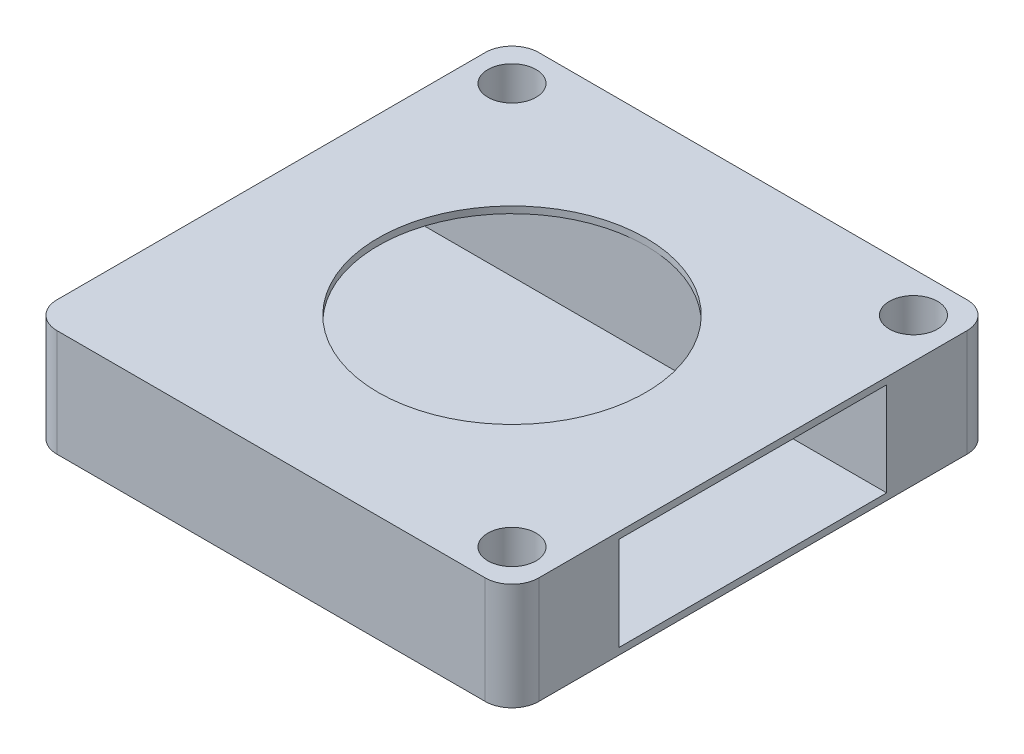
from build123d import *

# Parameters (mm, degrees)
BOSS_EXTRUDE1_DEPTH = 4
CUT_EXTRUDE1_REACH  = 15.342
SKETCH4_R           = 0.9
SKETCH5_R           = 5
CUT_EXTRUDE2_DEPTH  = 3.75
SKETCH6_W           = 10
SKETCH6_H           = 3.5
CUT_EXTRUDE3_DEPTH  = 17.5


with BuildPart() as part:
    # Sketch3 → Boss-Extrude1 (new body)
    with BuildSketch(Plane(origin=(0, 0, 0), x_dir=(1, 0, 0), z_dir=(0, 1, 0))):
        with BuildLine():
            Line((-8, -9), (8, -9))
            ThreePointArc((8, -9), (8.707106781, -8.707106781), (9, -8))
            Line((9, -8), (9, 8))
            ThreePointArc((9, 8), (8.707106781, 8.707106781), (8, 9))
            Line((8, 9), (-8, 9))
            ThreePointArc((-8, 9), (-8.707106781, 8.707106781), (-9, 8))
            Line((-9, 8), (-9, -8))
            ThreePointArc((-9, -8), (-8.707106781, -8.707106781), (-8, -9))
        make_face()
    extrude(amount=BOSS_EXTRUDE1_DEPTH)

    # Sketch4 → Cut-Extrude1 (cut, up to next)
    with BuildSketch(Plane(origin=(0, 4, 0), x_dir=(1, 0, 0), z_dir=(0, 1, 0)), mode=Mode.PRIVATE) as cut_extrude1_sk1:
        with Locations(Location((7.5, -7.5, 0), (0, 0, 270))):
            Circle(SKETCH4_R)
    cut_extrude1_tool1 = extrude(cut_extrude1_sk1.sketch, amount=-CUT_EXTRUDE1_REACH, mode=Mode.PRIVATE) & part.part
    # Sketch4 → Cut-Extrude1 (cut, up to next)
    with BuildSketch(Plane(origin=(0, 4, 0), x_dir=(1, 0, 0), z_dir=(0, 1, 0)), mode=Mode.PRIVATE) as cut_extrude1_sk2:
        with Locations(Location((7.5, 7.5, 0), (0, 0, 270))):
            Circle(SKETCH4_R)
    cut_extrude1_tool2 = extrude(cut_extrude1_sk2.sketch, amount=-CUT_EXTRUDE1_REACH, mode=Mode.PRIVATE) & part.part
    # Sketch4 → Cut-Extrude1 (cut, up to next)
    with BuildSketch(Plane(origin=(0, 4, 0), x_dir=(1, 0, 0), z_dir=(0, 1, 0)), mode=Mode.PRIVATE) as cut_extrude1_sk3:
        with Locations(Location((-7.5, 7.5, 0), (0, 0, 270))):
            Circle(SKETCH4_R)
    cut_extrude1_tool3 = extrude(cut_extrude1_sk3.sketch, amount=-CUT_EXTRUDE1_REACH, mode=Mode.PRIVATE) & part.part
    add(cut_extrude1_tool1.solids().sort_by_distance((7.5, 4, 7.5))[0], mode=Mode.SUBTRACT)
    add(cut_extrude1_tool2.solids().sort_by_distance((7.5, 4, -7.5))[0], mode=Mode.SUBTRACT)
    add(cut_extrude1_tool3.solids().sort_by_distance((-7.5, 4, -7.5))[0], mode=Mode.SUBTRACT)

    # Sketch5 → Cut-Extrude2 (cut)
    with BuildSketch(Plane(origin=(0, 4, 0), x_dir=(1, 0, 0), z_dir=(0, 1, 0))):
        with Locations(Location((0, 0, 0), (0, 0, 270))):
            Circle(SKETCH5_R)
    extrude(amount=-CUT_EXTRUDE2_DEPTH, mode=Mode.SUBTRACT)

    # Sketch6 → Cut-Extrude3 (cut)
    with BuildSketch(Plane(origin=(9, 0, 0), x_dir=(0, 0, -1), z_dir=(1, 0, 0))):
        with Locations((0, 2)):
            Rectangle(SKETCH6_W, SKETCH6_H)
    extrude(amount=-CUT_EXTRUDE3_DEPTH, mode=Mode.SUBTRACT)


solid = part.part
